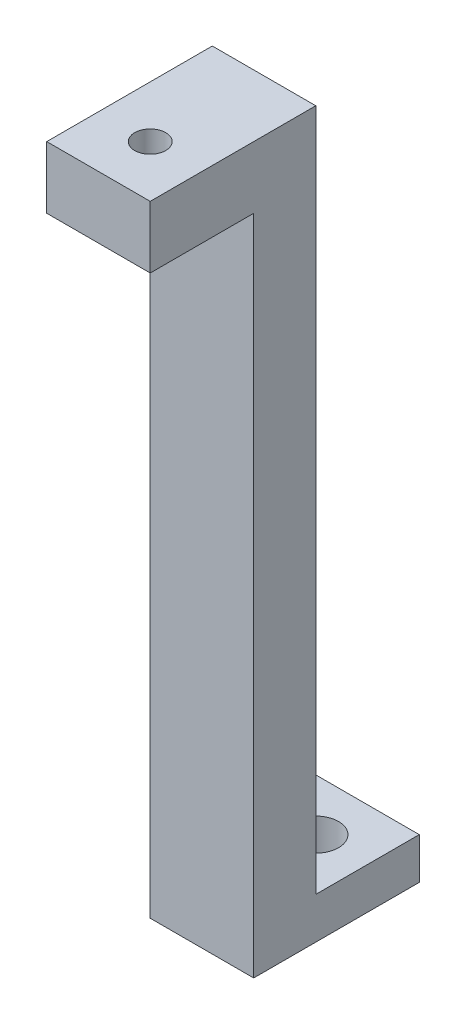
from build123d import *

# Parameters (mm, degrees)
SKETCH_1_W      = 5
SKETCH_1_H      = 5
SKETCH_1_R      = 1.1
EXTRUDE_1_DEPTH = 2
SKETCH_2_W      = 5
SKETCH_2_H      = 3
EXTRUDE_2_DEPTH = 35
SKETCH_3_W      = 5
SKETCH_3_H      = 5
SKETCH_3_R      = 0.75
EXTRUDE_3_DEPTH = 3


with BuildPart() as part:
    # 草图1 → 凸台-拉伸1 (new body)
    with BuildSketch(Plane(origin=(0, 0, 0), x_dir=(1, 0, 0), z_dir=(0, 1, 0))):
        Rectangle(SKETCH_1_W, SKETCH_1_H)
        with Locations(Location((0, 0, 0), (0, 0, 270))):
            Circle(SKETCH_1_R, mode=Mode.SUBTRACT)
    extrude(amount=EXTRUDE_1_DEPTH)

    # 草图2 → 凸台-拉伸2 (add)
    with BuildSketch(Plane.XZ):
        with Locations((0, 4)):
            Rectangle(SKETCH_2_W, SKETCH_2_H)
    extrude(amount=-EXTRUDE_2_DEPTH)

    # 草图3 → 凸台-拉伸3 (add)
    with BuildSketch(Plane(origin=(0, 35, 0), x_dir=(1, 0, 0), z_dir=(0, 1, 0))):
        with Locations((0, -8)):
            Rectangle(SKETCH_3_W, SKETCH_3_H)
        with Locations(Location((0, -8, 0), (0, 0, 270))):
            Circle(SKETCH_3_R, mode=Mode.SUBTRACT)
    extrude(amount=-EXTRUDE_3_DEPTH)


solid = part.part
